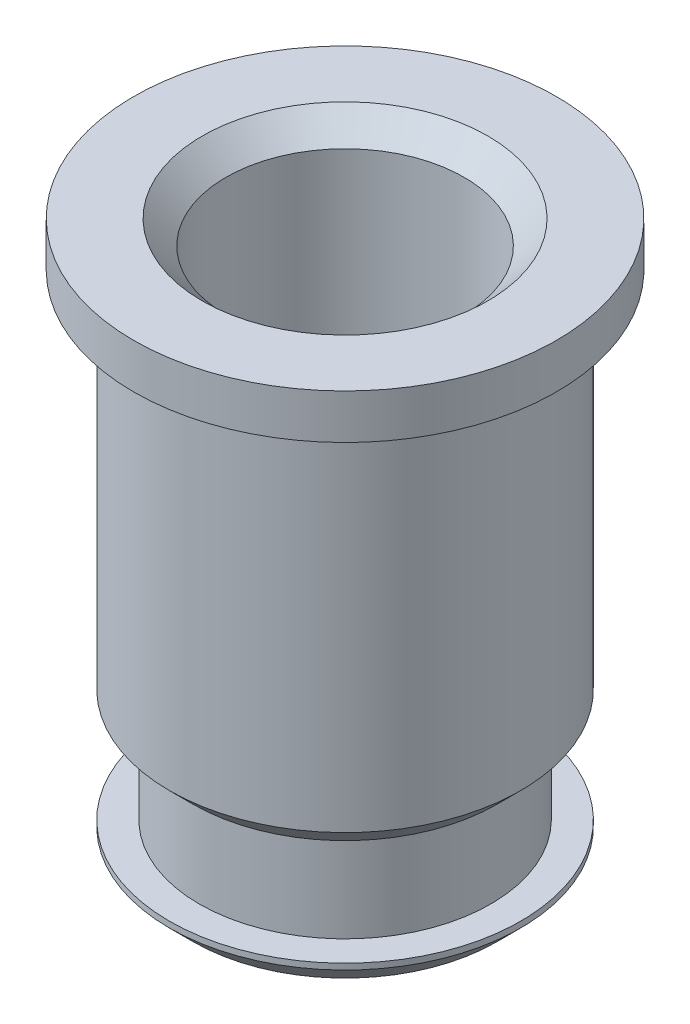
from build123d import *

# Parameters (mm, degrees)
SKETCH_1_R      = 2.95
SKETCH_1_R_2    = 2
EXTRUDE_1_DEPTH = 8.5
EXTRUDE_START   = 0.75
SKETCH_2_R      = 3.55
SKETCH_2_R_2    = 2
EXTRUDE_2_DEPTH = 0.75
SKETCH_3_W      = 0.5
SKETCH_3_H      = 1.5
CHAMFER_1_SIZE  = 0.4


with BuildPart() as part:
    # 草图1 → 凸台-拉伸1 (new body)
    with BuildSketch(Plane(origin=(0, 0, 0), x_dir=(1, 0, 0), z_dir=(0, 1, 0))):
        with Locations(Location((0, 0, 0), (0, 0, 270))):
            Circle(SKETCH_1_R)
        with Locations(Location((0, 0, 0), (0, 0, 270))):
            Circle(SKETCH_1_R_2, mode=Mode.SUBTRACT)
    extrude(amount=-EXTRUDE_1_DEPTH)

    # 草图2 → 凸台-拉伸2 (add)
    with BuildSketch(Plane(origin=(0, 0, 0), x_dir=(1, 0, 0), z_dir=(0, 1, 0)).offset(EXTRUDE_START)):
        with Locations(Location((0, 0, 0), (0, 0, 270))):
            Circle(SKETCH_2_R)
        with Locations(Location((0, 0, 0), (0, 0, 270))):
            Circle(SKETCH_2_R_2, mode=Mode.SUBTRACT)
    extrude(amount=-EXTRUDE_2_DEPTH)

    # 草图3 → 切除-旋转1 (revolve, cut)
    with BuildSketch(Plane(origin=(0, 0, 0), x_dir=(0, 0, -1), z_dir=(1, 0, 0))):
        with Locations((-2.7, -7.25)):
            Rectangle(SKETCH_3_W, SKETCH_3_H)
    revolve(axis=Axis((0, 0, 0), (0, -1, 0)), mode=Mode.SUBTRACT)

    # 倒角1
    chamfer_1_edges = [part.edges().sort_by_distance(p)[0] for p in [
        (0, 0.75, -2),
        (0, -6.5, -2.95),
        (0, -8.5, -2.95),
    ]]
    chamfer(chamfer_1_edges, length=CHAMFER_1_SIZE)


solid = part.part
